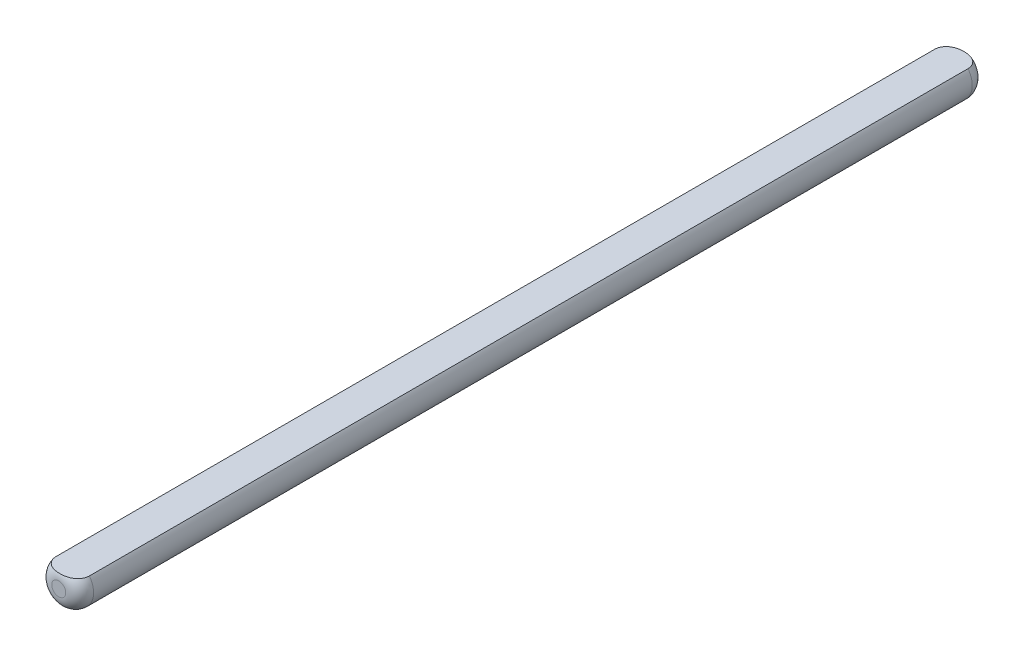
from build123d import *

# Parameters (mm, degrees)
ESQUISSE1_R             = 3
BOSS_EXTRU_1_DEPTH      = 130
CONG_1_R                = 2
ESQUISSE2_W             = 6
ESQUISSE2_H             = 1.2
ENL_V_MAT_EXTRU_1_DEPTH = 131.069212347


with BuildPart() as part:
    # Esquisse1 → Boss.-Extru.1 (new body)
    with BuildSketch(Plane.XY):
        Circle(ESQUISSE1_R)
    extrude(amount=BOSS_EXTRU_1_DEPTH)

    # Congé1
    cong_1_edges = [part.edges().sort_by_distance(p)[0] for p in [
        (-3, 0, 0),
        (-3, 0, 130),
    ]]
    fillet(cong_1_edges, radius=CONG_1_R)

    # Esquisse2 → Enlèv. mat.-Extru.1 (cut, through all)
    with BuildSketch(Plane.XY.offset(130)):
        with Locations((0, 2.4)):
            Rectangle(ESQUISSE2_W, ESQUISSE2_H)
    extrude(amount=-ENL_V_MAT_EXTRU_1_DEPTH, mode=Mode.SUBTRACT)


solid = part.part
